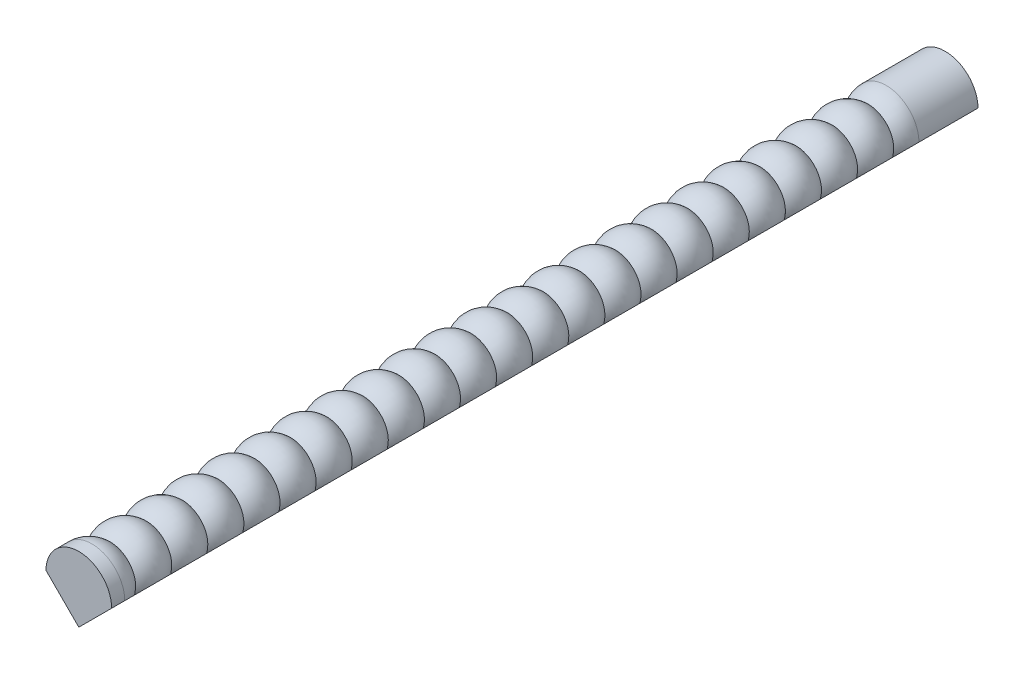
from build123d import *

# Parameters (mm, degrees)
CUT_EXTRUDE3_DEPTH = 140


with BuildPart() as part:
    # Sketch1 → Revolve1 (revolve)
    with BuildSketch(Plane(origin=(0, 0, 0), x_dir=(0, 0, -1), z_dir=(1, 0, 0)), mode=Mode.PRIVATE) as revolve1_sk:
        with BuildLine():
            Line((0, 0), (0, 5))
            Line((0, 5), (2, 5))
            ThreePointArc((2, 5), (3.480042223, 4.7161102), (4.75, 3.90473751))
            ThreePointArc((4.75, 3.90473751), (7.5, 5), (10.25, 3.90473751))
            ThreePointArc((10.25, 3.90473751), (13, 5), (15.75, 3.90473751))
            ThreePointArc((15.75, 3.90473751), (18.5, 5), (21.25, 3.90473751))
            ThreePointArc((21.25, 3.90473751), (24, 5), (26.75, 3.90473751))
            ThreePointArc((26.75, 3.90473751), (29.5, 5), (32.25, 3.90473751))
            ThreePointArc((32.25, 3.90473751), (35, 5), (37.75, 3.90473751))
            ThreePointArc((37.75, 3.90473751), (40.5, 5), (43.25, 3.90473751))
            ThreePointArc((43.25, 3.90473751), (46, 5), (48.75, 3.90473751))
            ThreePointArc((48.75, 3.90473751), (51.5, 5), (54.25, 3.90473751))
            ThreePointArc((54.25, 3.90473751), (57, 5), (59.75, 3.90473751))
            ThreePointArc((59.75, 3.90473751), (62.5, 5), (65.25, 3.90473751))
            ThreePointArc((65.25, 3.90473751), (68, 5), (70.75, 3.90473751))
            ThreePointArc((70.75, 3.90473751), (73.5, 5), (76.25, 3.90473751))
            ThreePointArc((76.25, 3.90473751), (79, 5), (81.75, 3.90473751))
            ThreePointArc((81.75, 3.90473751), (84.5, 5), (87.25, 3.90473751))
            ThreePointArc((87.25, 3.90473751), (90, 5), (92.75, 3.90473751))
            ThreePointArc((92.75, 3.90473751), (95.5, 5), (98.25, 3.90473751))
            ThreePointArc((98.25, 3.90473751), (101, 5), (103.75, 3.90473751))
            ThreePointArc((103.75, 3.90473751), (106.5, 5), (109.25, 3.90473751))
            ThreePointArc((109.25, 3.90473751), (112, 5), (114.75, 3.90473751))
            ThreePointArc((114.75, 3.90473751), (117.5, 5), (120.25, 3.90473751))
            ThreePointArc((120.25, 3.90473751), (121.519957777, 4.7161102), (123, 5))
            Line((123, 5), (132, 5))
            Line((132, 5), (132, 1))
            Line((132, 1), (123, 1))
            Line((123, 1), (123, 3))
            ThreePointArc((123, 3), (121.585786438, 2.414213562), (121, 1))
            Line((121, 1), (120.25, 1))
            Line((120.25, 1), (119.5, 1))
            ThreePointArc((119.5, 1), (117.5, 3), (115.5, 1))
            Line((115.5, 1), (114.75, 1))
            Line((114.75, 1), (114, 1))
            ThreePointArc((114, 1), (112, 3), (110, 1))
            Line((110, 1), (109.25, 1))
            Line((109.25, 1), (108.5, 1))
            ThreePointArc((108.5, 1), (106.5, 3), (104.5, 1))
            Line((104.5, 1), (103.75, 1))
            Line((103.75, 1), (103, 1))
            ThreePointArc((103, 1), (101, 3), (99, 1))
            Line((99, 1), (98.25, 1))
            Line((98.25, 1), (97.5, 1))
            ThreePointArc((97.5, 1), (95.5, 3), (93.5, 1))
            Line((93.5, 1), (92.75, 1))
            Line((92.75, 1), (92, 1))
            ThreePointArc((92, 1), (90, 3), (88, 1))
            Line((88, 1), (87.25, 1))
            Line((87.25, 1), (86.5, 1))
            ThreePointArc((86.5, 1), (84.5, 3), (82.5, 1))
            Line((82.5, 1), (81.75, 1))
            Line((81.75, 1), (81, 1))
            ThreePointArc((81, 1), (79, 3), (77, 1))
            Line((77, 1), (76.25, 1))
            Line((76.25, 1), (75.5, 1))
            ThreePointArc((75.5, 1), (73.5, 3), (71.5, 1))
            Line((71.5, 1), (70.75, 1))
            Line((70.75, 1), (70, 1))
            ThreePointArc((70, 1), (68, 3), (66, 1))
            Line((66, 1), (65.25, 1))
            Line((65.25, 1), (64.5, 1))
            ThreePointArc((64.5, 1), (62.5, 3), (60.5, 1))
            Line((60.5, 1), (59.75, 1))
            Line((59.75, 1), (59, 1))
            ThreePointArc((59, 1), (57, 3), (55, 1))
            Line((55, 1), (54.25, 1))
            Line((54.25, 1), (53.5, 1))
            ThreePointArc((53.5, 1), (51.5, 3), (49.5, 1))
            Line((49.5, 1), (48.75, 1))
            Line((48.75, 1), (48, 1))
            ThreePointArc((48, 1), (46, 3), (44, 1))
            Line((44, 1), (43.25, 1))
            Line((43.25, 1), (42.5, 1))
            ThreePointArc((42.5, 1), (40.5, 3), (38.5, 1))
            Line((38.5, 1), (37.75, 1))
            Line((37.75, 1), (37, 1))
            ThreePointArc((37, 1), (35, 3), (33, 1))
            Line((33, 1), (32.25, 1))
            Line((32.25, 1), (31.5, 1))
            ThreePointArc((31.5, 1), (29.5, 3), (27.5, 1))
            Line((27.5, 1), (26.75, 1))
            Line((26.75, 1), (26, 1))
            ThreePointArc((26, 1), (24, 3), (22, 1))
            Line((22, 1), (21.25, 1))
            Line((21.25, 1), (20.5, 1))
            ThreePointArc((20.5, 1), (18.5, 3), (16.5, 1))
            Line((16.5, 1), (15.75, 1))
            Line((15.75, 1), (15, 1))
            ThreePointArc((15, 1), (13, 3), (11, 1))
            Line((11, 1), (10.25, 1))
            Line((10.25, 1), (9.5, 1))
            ThreePointArc((9.5, 1), (7.5, 3), (5.5, 1))
            Line((5.5, 1), (4.75, 1))
            Line((4.75, 1), (4, 1))
            ThreePointArc((4, 1), (3.414213562, 2.414213562), (2, 3))
            Line((2, 3), (2, 1))
            Line((2, 1), (2, 0))
            Line((2, 0), (0, 0))
        make_face()
    revolve(revolve1_sk.sketch.rotate(Axis((0, 0, 0), (0, 0, -1)), 90), axis=Axis((0, 0, 0), (0, 0, -1)))

    # Sketch2 → Cut-Extrude3 (cut)
    with BuildSketch(Plane(origin=(0, 0, -132), x_dir=(-1, 0, 0), z_dir=(0, 0, -1))):
        with BuildLine():
            Line((0, -5), (-5, 0))
            ThreePointArc((-5, 0), (-3.535533906, -3.535533906), (0, -5))
        make_face()
        with BuildLine():
            Line((5, 0), (0, -5))
            ThreePointArc((0, -5), (3.535533906, -3.535533906), (5, 0))
        make_face()
    extrude(amount=-CUT_EXTRUDE3_DEPTH, mode=Mode.SUBTRACT)


solid = part.part
